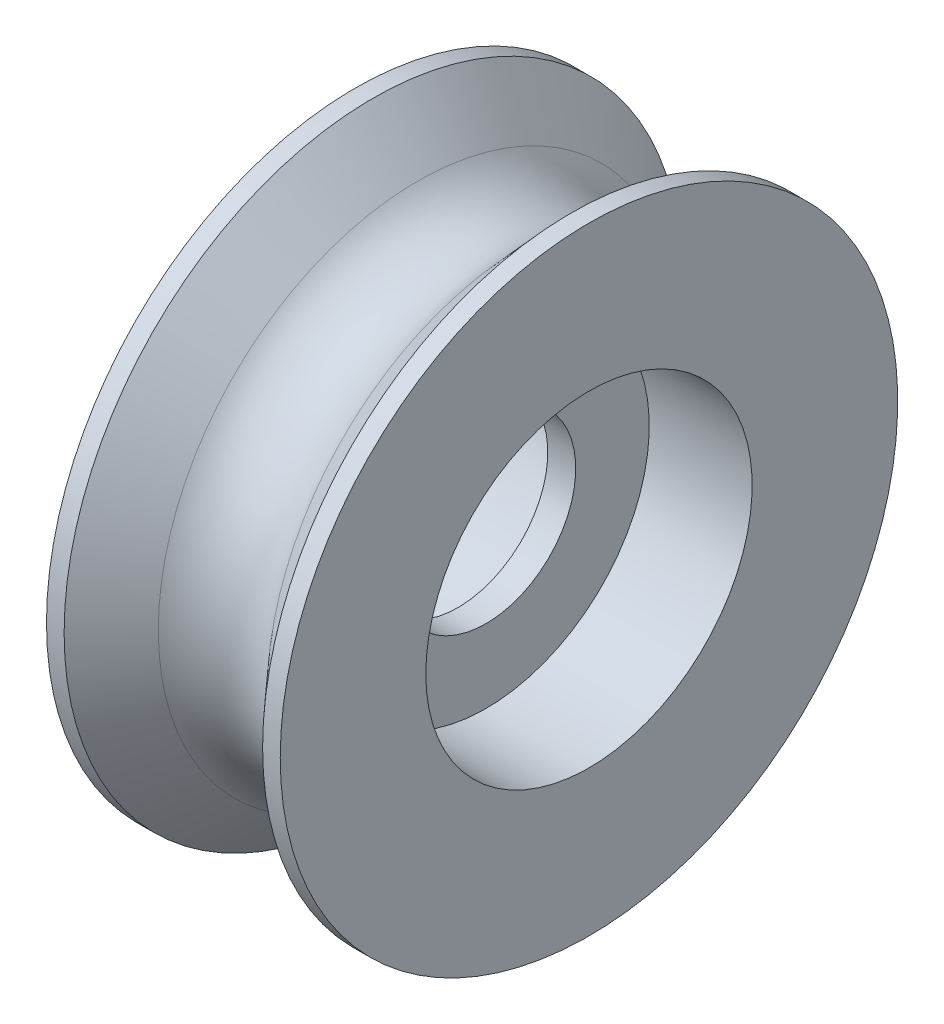
from build123d import *


with BuildPart() as part:
    # Sketch1 → Revolve1 (revolve)
    with BuildSketch(Plane(origin=(0, 0, 0), x_dir=(1, 0, 0), z_dir=(0, 1, 0)), mode=Mode.PRIVATE) as revolve1_sk:
        with BuildLine():
            Line((-7.95, 11.1), (-0.95, 11.1))
            Line((-0.95, 11.1), (-0.95, 6.1))
            Line((-0.95, 6.1), (0.95, 6.1))
            Line((0.95, 6.1), (0.95, 11.1))
            Line((0.95, 11.1), (7.95, 11.1))
            Line((7.95, 11.1), (7.95, 21))
            Line((7.95, 21), (6.75, 21))
            Line((6.75, 21), (3.703703704, 17.641044973))
            ThreePointArc((3.703703704, 17.641044973), (0, 16), (-3.703703704, 17.641044973))
            Line((-3.703703704, 17.641044973), (-6.75, 21))
            Line((-6.75, 21), (-7.95, 21))
            Line((-7.95, 21), (-7.95, 11.1))
        make_face()
    revolve(revolve1_sk.sketch.rotate(Axis((-3.715814159, 0, 0), (1, 0, 0)), 180), axis=Axis((-3.715814159, 0, 0), (1, 0, 0)))


solid = part.part
